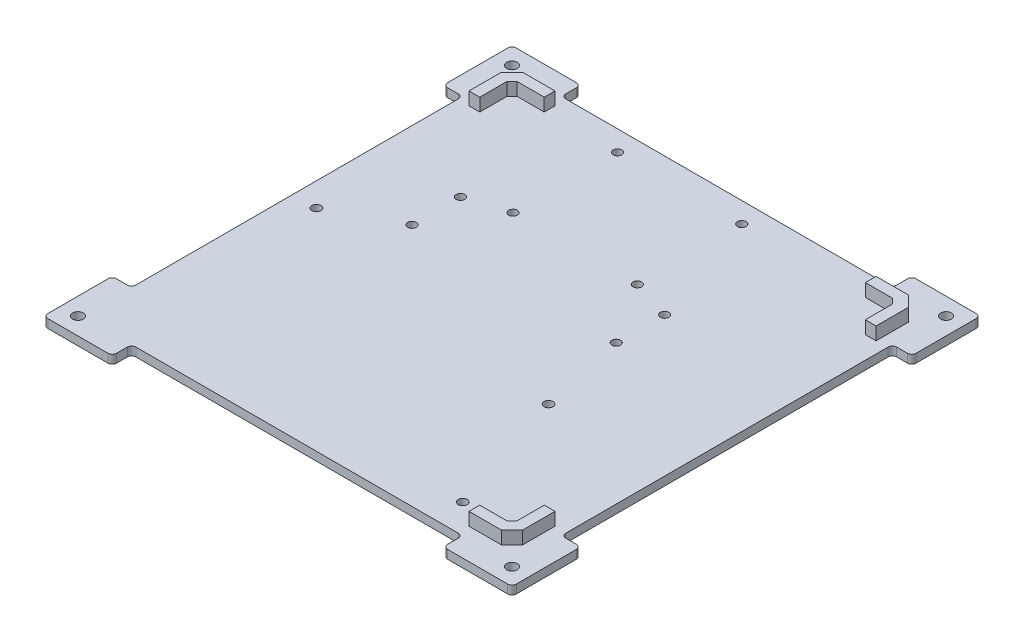
from build123d import *

# Parameters (mm, degrees)
ESQUISSE1_R             = 2.5
BOSS_EXTRU_1_DEPTH      = 4
ESQUISSE2_R             = 2.1
ESQUISSE2_R_2           = 2
ENL_V_MAT_EXTRU_1_DEPTH = 4
BOSS_EXTRU_2_DEPTH      = 6
CONG_1_R                = 2


with BuildPart() as part:
    # Esquisse1 → Boss.-Extru.1 (new body)
    with BuildSketch(Plane(origin=(0, 0, 0), x_dir=(1, 0, 0), z_dir=(0, 1, 0))):
        Polygon((0, 218), (0, 186), (9, 186), (9, 32), (0, 32), (0, 0), (32, 0), (32, 9), (186, 9), (186, 0), (218, 0), (218, 32), (209, 32), (209, 186), (218, 186), (218, 218), (186, 218), (186, 209), (32, 209), (32, 218), align=None)
        with Locations(Location((8, 210, 0), (0, 0, 270))):
            Circle(ESQUISSE1_R, mode=Mode.SUBTRACT)
        with Locations(Location((210, 210, 0), (0, 0, 270))):
            Circle(ESQUISSE1_R, mode=Mode.SUBTRACT)
        with Locations(Location((210, 8, 0), (0, 0, 270))):
            Circle(ESQUISSE1_R, mode=Mode.SUBTRACT)
        with Locations(Location((8, 8, 0), (0, 0, 270))):
            Circle(ESQUISSE1_R, mode=Mode.SUBTRACT)
    extrude(amount=BOSS_EXTRU_1_DEPTH)

    # Esquisse2 → Enlèv. mat.-Extru.1 (cut)
    with BuildSketch(Plane(origin=(0, 4, 0), x_dir=(1, 0, 0), z_dir=(0, 1, 0))):
        with Locations(Location((172.5, 22.6, 0), (0, 0, 90))):
            Circle(ESQUISSE2_R)
        with Locations(Location((153, 82, 0), (0, 0, 90))):
            Circle(ESQUISSE2_R)
        with Locations(Location((20, 107, 0), (0, 0, 90))):
            Circle(ESQUISSE2_R)
        with Locations(Location((49, 122.5, 0), (0, 0, 270))):
            Circle(ESQUISSE2_R_2)
        with Locations(Location((144, 122.5, 0), (0, 0, 270))):
            Circle(ESQUISSE2_R_2)
        with Locations(Location((144, 145, 0), (0, 0, 270))):
            Circle(ESQUISSE2_R_2)
        with Locations(Location((49, 145, 0), (0, 0, 270))):
            Circle(ESQUISSE2_R_2)
        with Locations(Location((67.6, 199.5, 0), (0, 0, 270))):
            Circle(ESQUISSE2_R_2)
        with Locations(Location((67.6, 150.9, 0), (0, 0, 270))):
            Circle(ESQUISSE2_R_2)
        with Locations(Location((125.4, 150.9, 0), (0, 0, 90))):
            Circle(ESQUISSE2_R_2)
        with Locations(Location((125.4, 199.5, 0), (0, 0, 90))):
            Circle(ESQUISSE2_R_2)
    extrude(amount=-ENL_V_MAT_EXTRU_1_DEPTH, mode=Mode.SUBTRACT)

    # Esquisse4 → Boss.-Extru.2 (add)
    with BuildSketch(Plane(origin=(0, 4, 0), x_dir=(1, 0, 0), z_dir=(0, 1, 0))):
        Polygon((198.7, 14.3), (183.7, 14.3), (183.7, 19.3), (196.353215425, 19.3), (198.7, 21.646784575), (198.7, 34.3), (203.7, 34.3), (203.7, 19.3), align=None)
        Polygon((19.3, 203.7), (34.3, 203.7), (34.3, 198.7), (21.646784575, 198.7), (19.3, 196.353215425), (19.3, 183.7), (14.3, 183.7), (14.3, 198.7), align=None)
        Polygon((203.7, 198.7), (203.7, 183.7), (198.7, 183.7), (198.7, 196.353215425), (196.353215425, 198.7), (183.7, 198.7), (183.7, 203.7), (198.7, 203.7), align=None)
    extrude(amount=BOSS_EXTRU_2_DEPTH)

    # Congé1
    cong_1_edges = [part.edges().sort_by_distance(p)[0] for p in [
        (0, 2, 0),
        (0, 2, -32),
        (9, 2, -32),
        (9, 2, -186),
        (0, 2, -186),
        (0, 2, -218),
        (32, 2, -218),
        (32, 2, -209),
        (186, 2, -209),
        (186, 2, -218),
        (218, 2, -218),
        (218, 2, -186),
        (209, 2, -186),
        (209, 2, -32),
        (218, 2, -32),
        (218, 2, 0),
        (186, 2, 0),
        (186, 2, -9),
        (32, 2, -9),
        (32, 2, 0),
    ]]
    fillet(cong_1_edges, radius=CONG_1_R)


solid = part.part
